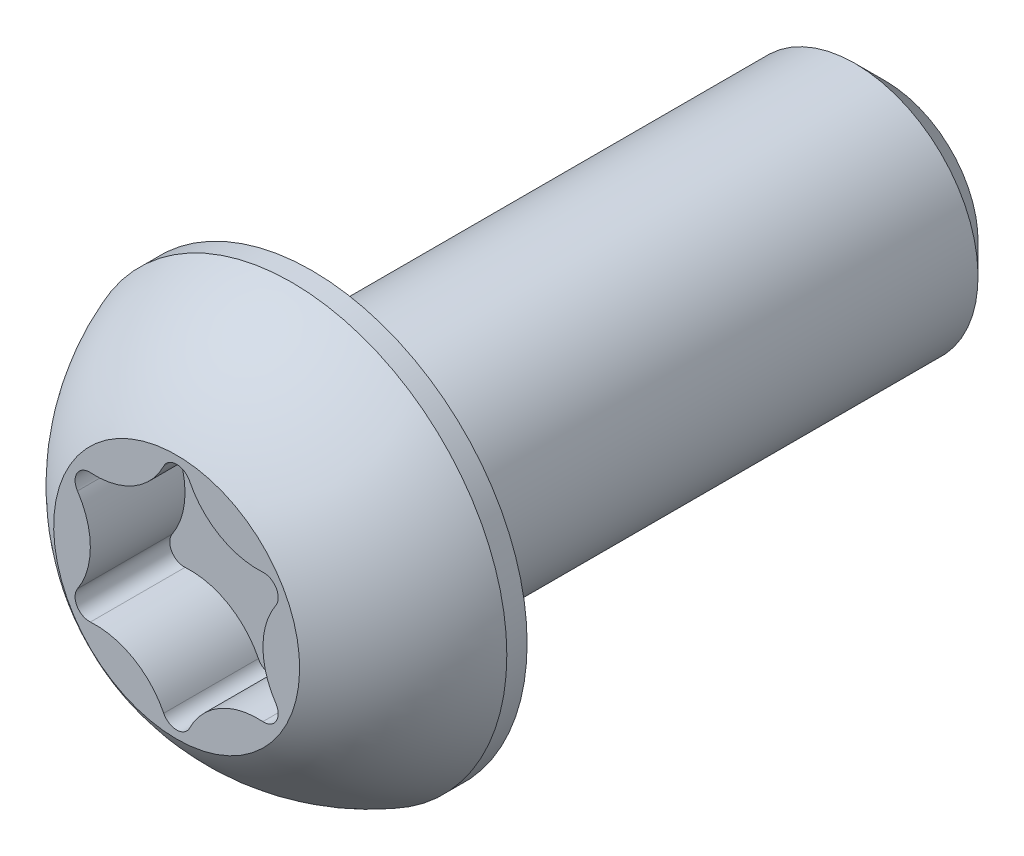
from build123d import *

# Parameters (mm, degrees)
SKETCH12_W         = 14
SKETCH12_H         = 3
CUT_EXTRUDE4_DEPTH = 2.31
CIRPATTERN1_COUNT  = 6
CHAMFER1_SIZE      = 0.75


with BuildPart() as part:
    # Sketch12 → Revolve1 (revolve)
    with BuildSketch(Plane(origin=(0, 0, 0), x_dir=(0, 0, -1), z_dir=(1, 0, 0))):
        with Locations((0, 1.5)):
            Rectangle(SKETCH12_W, SKETCH12_H)
    revolve(axis=Axis((0, 0, -7), (0, 0, 1)))

    # Sketch7 → Revolve2 (revolve)
    with BuildSketch(Plane(origin=(0, 0, 0), x_dir=(0, 0, -1), z_dir=(1, 0, 0))):
        with BuildLine():
            Line((-7.495, 5.25), (-7, 5.25))
            Line((-7, 5.25), (-7, 0))
            Line((-7, 0), (-10.3, 0))
            Line((-10.3, 0), (-10.3, 3))
            ThreePointArc((-10.3, 3), (-9.083520981, 4.356906156), (-7.495, 5.25))
        make_face()
    revolve(axis=Axis((0, 0, 10.3), (0, 0, -1)))

    # Sketch11 → Cut-Extrude4 (cut)
    with BuildSketch(Plane.XY.offset(10.3)):
        with BuildLine():
            Line((0, 0), (-2.430673501, 1.40335))
            ThreePointArc((-2.430673501, 1.40335), (-2.477487573, 1.216409562), (-2.418502657, 1.032945493))
            ThreePointArc((-2.418502657, 1.032945493), (-2.105025, 0), (-2.418502657, -1.032945493))
            ThreePointArc((-2.418502657, -1.032945493), (-2.477487573, -1.216409562), (-2.430673501, -1.40335))
            Line((-2.430673501, -1.40335), (0, 0))
        make_face()
    cut_extrude4 = extrude(amount=-CUT_EXTRUDE4_DEPTH, mode=Mode.SUBTRACT)

    # CirPattern1: Cut-Extrude4 ×6 about axis
    cirpattern1_axis = Axis((0, 0, 0), (0, 0, -1))
    for i in range(1, CIRPATTERN1_COUNT):
        add(cut_extrude4.rotate(cirpattern1_axis, i * 360 / CIRPATTERN1_COUNT), mode=Mode.SUBTRACT)

    # Chamfer1
    chamfer1_edges = [part.edges().sort_by_distance(p)[0] for p in [
        (0, -3, -7),
    ]]
    chamfer(chamfer1_edges, length=CHAMFER1_SIZE)


solid = part.part
